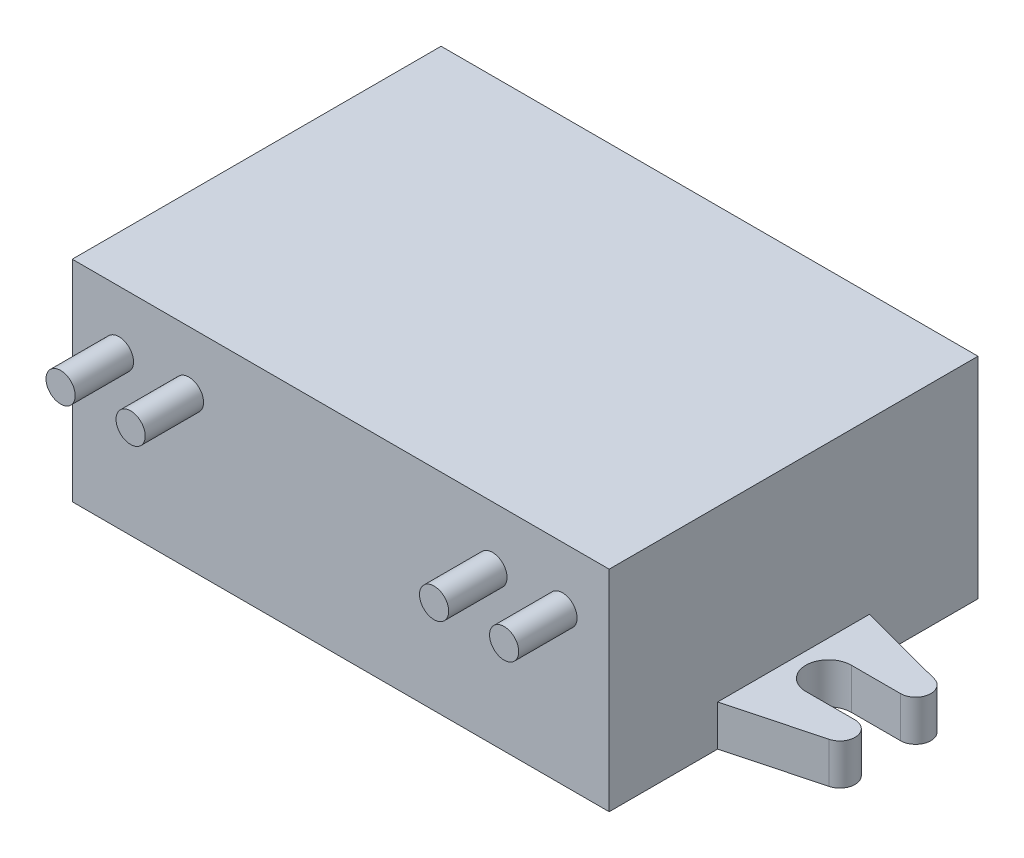
from build123d import *

# Parameters (mm, degrees)
SKETCH1_W           = 46
SKETCH1_H           = 31.6
BOSS_EXTRUDE1_DEPTH = 18
BOSS_EXTRUDE2_DEPTH = 3.5
SKETCH2_R           = 1.25
BOSS_EXTRUDE3_DEPTH = 5


with BuildPart() as part:
    # Sketch1 → Boss-Extrude1 (new body)
    with BuildSketch(Plane(origin=(0, 0, 0), x_dir=(1, 0, 0), z_dir=(0, 1, 0))):
        Rectangle(SKETCH1_W, SKETCH1_H)
    extrude(amount=BOSS_EXTRUDE1_DEPTH)

    # Sketch1<3> → Boss-Extrude2 (add)
    with BuildSketch(Plane(origin=(0, 0, 0), x_dir=(1, 0, 0), z_dir=(0, 1, 0))):
        with BuildLine():
            Line((-23, -6.5), (-23, 6.5))
            Line((-23, 6.5), (-30.546403177, 4.5))
            ThreePointArc((-30.546403177, 4.5), (-31.5, 3.079144467), (-30.214227812, 1.95))
            Line((-30.214227812, 1.95), (-26, 1.95))
            ThreePointArc((-26, 1.95), (-24.05, 0), (-26, -1.95))
            Line((-26, -1.95), (-30.214227812, -1.95))
            ThreePointArc((-30.214227812, -1.95), (-31.5, -3.079144467), (-30.546403177, -4.5))
            Line((-30.546403177, -4.5), (-23, -6.5))
        make_face()
        with BuildLine():
            Line((30.546403177, 4.5), (23, 6.5))
            Line((23, 6.5), (23, -6.5))
            Line((23, -6.5), (30.546403177, -4.5))
            ThreePointArc((30.546403177, -4.5), (31.5, -3.079144467), (30.214227812, -1.95))
            Line((30.214227812, -1.95), (26, -1.95))
            ThreePointArc((26, -1.95), (24.05, 0), (26, 1.95))
            Line((26, 1.95), (30.214227812, 1.95))
            ThreePointArc((30.214227812, 1.95), (31.5, 3.079144467), (30.546403177, 4.5))
        make_face()
    extrude(amount=BOSS_EXTRUDE2_DEPTH)

    # Sketch2 → Boss-Extrude3 (add)
    with BuildSketch(Plane.XY.offset(15.8)):
        with Locations(Location((19, 13, 0), (0, 0, 180))):
            Circle(SKETCH2_R)
        with Locations(Location((13, 13, 0), (0, 0, 180))):
            Circle(SKETCH2_R)
        with Locations(Location((-19, 13, 0), (0, 0, 180))):
            Circle(SKETCH2_R)
        with Locations(Location((-13, 13, 0), (0, 0, 180))):
            Circle(SKETCH2_R)
    extrude(amount=BOSS_EXTRUDE3_DEPTH)


solid = part.part
